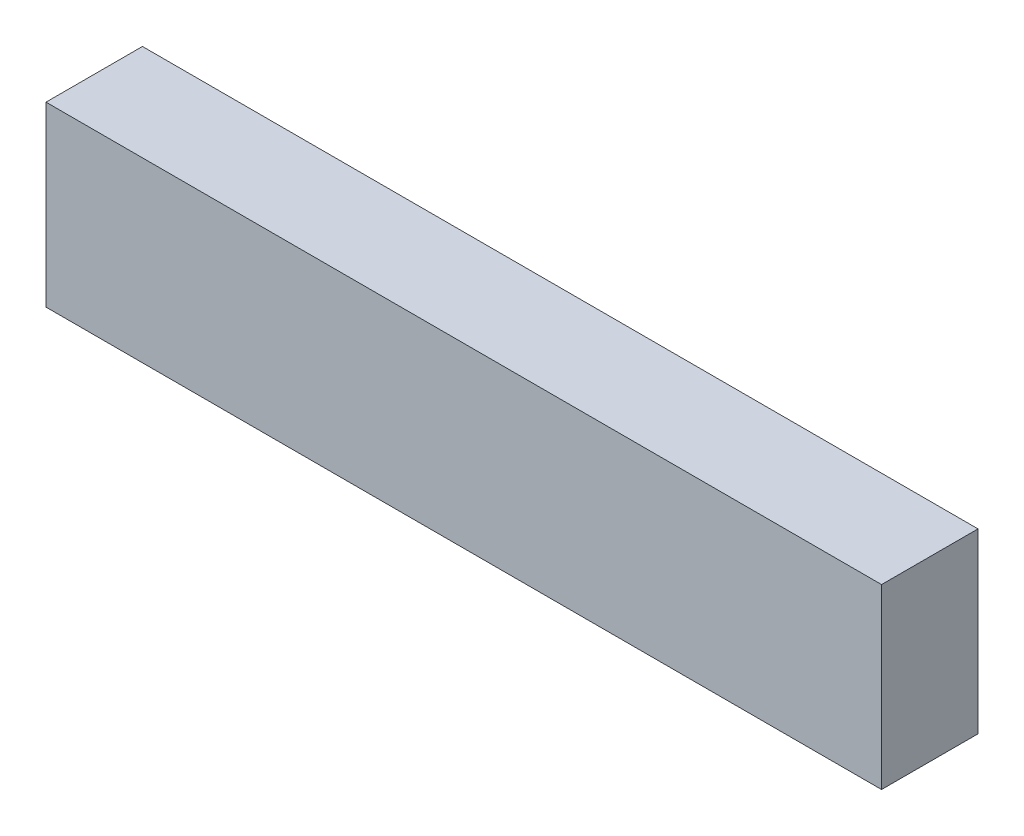
from build123d import *

# Parameters (mm, degrees)
SKETCH1_W           = 125.2
SKETCH1_H           = 26.6
BOSS_EXTRUDE1_DEPTH = 14.45


with BuildPart() as part:
    # Sketch1 → Boss-Extrude1 (new body)
    with BuildSketch(Plane.XY):
        Rectangle(SKETCH1_W, SKETCH1_H)
    extrude(amount=BOSS_EXTRUDE1_DEPTH)


solid = part.part
